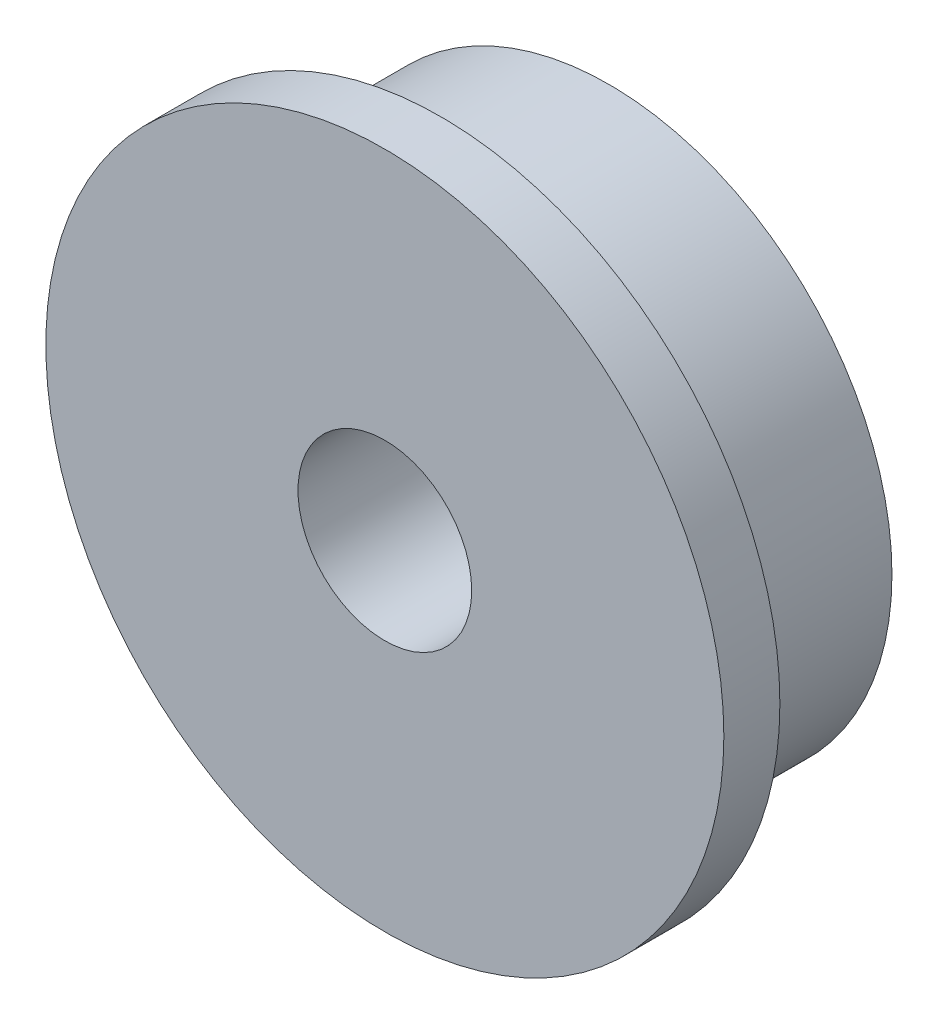
from build123d import *

# Parameters (mm, degrees)
SKETCH1_R           = 5.05
SKETCH1_R_2         = 1.55
BOSS_EXTRUDE1_DEPTH = 3
SKETCH2_R           = 6.05
SKETCH2_R_2         = 1.55
BOSS_EXTRUDE2_DEPTH = 1


with BuildPart() as part:
    # Sketch1 → Boss-Extrude1 (new body)
    with BuildSketch(Plane.XY):
        Circle(SKETCH1_R)
        Circle(SKETCH1_R_2, mode=Mode.SUBTRACT)
    extrude(amount=BOSS_EXTRUDE1_DEPTH)

    # Sketch2 → Boss-Extrude2 (add)
    with BuildSketch(Plane.XY.offset(3)):
        Circle(SKETCH2_R)
        Circle(SKETCH2_R_2, mode=Mode.SUBTRACT)
    extrude(amount=BOSS_EXTRUDE2_DEPTH)


solid = part.part
